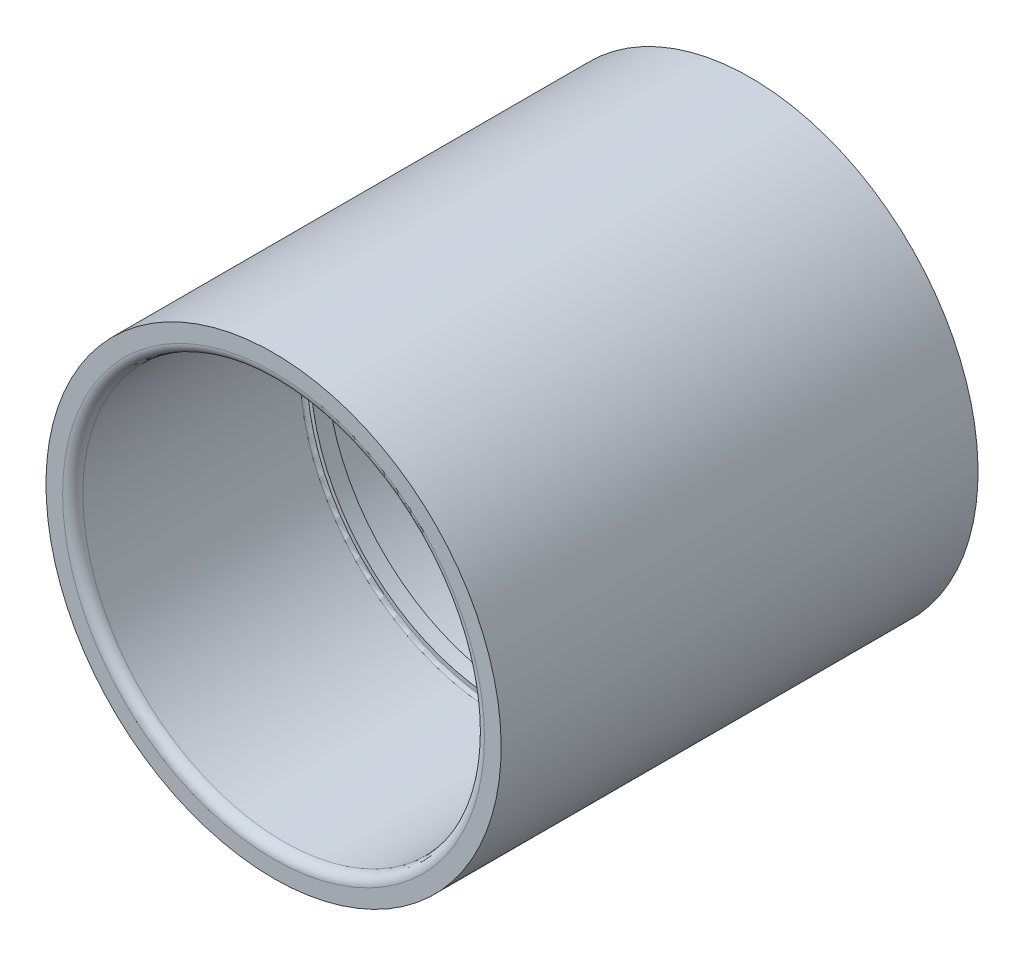
from build123d import *

# Parameters (mm, degrees)
FILLET1_R = 1.524
FILLET2_R = 0.508


with BuildPart() as part:
    # Sketch3 → Revolve1 (revolve)
    with BuildSketch(Plane(origin=(0, 0, 0), x_dir=(0, 0, -1), z_dir=(1, 0, 0))):
        Polygon((-35.9918, -34.3535), (35.9918, -34.3535), (35.9918, -30.3149), (1.1938, -30.3149), (1.1938, -29.1973), (-1.1938, -29.1973), (-1.1938, -30.3149), (-35.9918, -30.3149), align=None)
    revolve(axis=Axis((0, 0, 35.9918), (0, 0, -1)))

    # Fillet1
    fillet1_edges = [part.edges().sort_by_distance(p)[0] for p in [
        (0, 30.3149, -35.9918),
        (0, 30.3149, 35.9918),
    ]]
    fillet(fillet1_edges, radius=FILLET1_R)

    # Fillet2
    fillet2_edges = [part.edges().sort_by_distance(p)[0] for p in [
        (0, 30.3149, -1.1938),
        (0, 30.3149, 1.1938),
    ]]
    fillet(fillet2_edges, radius=FILLET2_R)


solid = part.part
